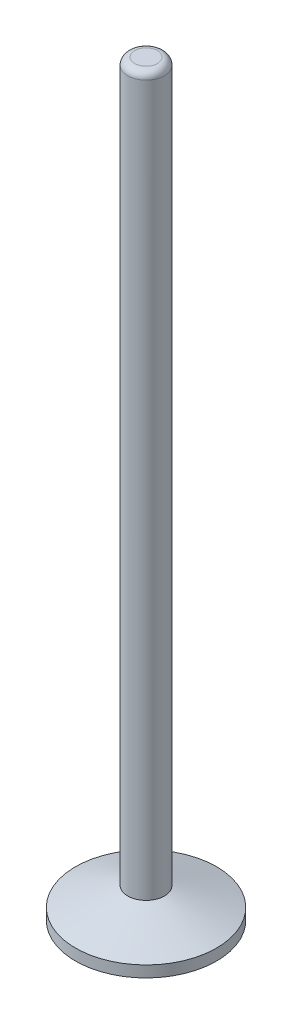
from build123d import *

# Parameters (mm, degrees)
CONG_1_R = 5


with BuildPart() as part:
    # Esquisse2 → Révolution1 (revolve)
    with BuildSketch(Plane.XY, mode=Mode.PRIVATE) as r_volution1_sk:
        Polygon((0, 0), (0, 530), (13, 530), (13, 21.466898668), (50, 8), (50, 0), align=None)
    revolve(r_volution1_sk.sketch.rotate(Axis((0, 0, 0), (0, 1, 0)), 90), axis=Axis((0, 0, 0), (0, 1, 0)))

    # Congé1
    cong_1_edges = [part.edges().sort_by_distance(p)[0] for p in [
        (0, 530, 13),
    ]]
    fillet(cong_1_edges, radius=CONG_1_R)


solid = part.part
